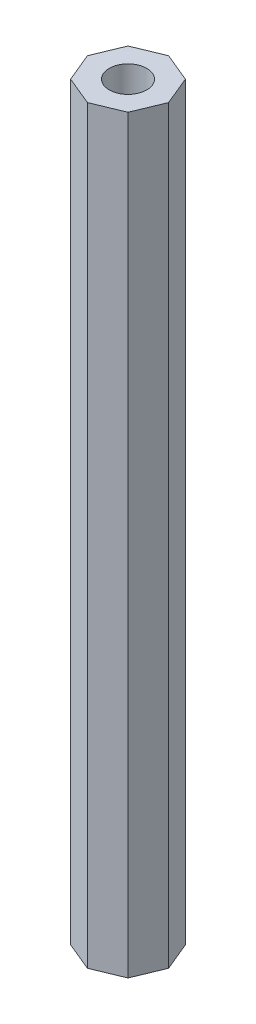
from build123d import *

# Parameters (mm, degrees)
SKETCH1_R           = 0.75
BOSS_EXTRUDE1_DEPTH = 30


with BuildPart() as part:
    # Sketch1 → Boss-Extrude1 (new body)
    with BuildSketch(Plane(origin=(0, 0, 0), x_dir=(1, 0, 0), z_dir=(0, 1, 0))):
        Polygon((1.6235883, 0), (1.148050297, 1.148050297), (0, 1.6235883), (-1.148050297, 1.148050297), (-1.6235883, 0), (-1.148050297, -1.148050297), (0, -1.6235883), (1.148050297, -1.148050297), align=None)
        with Locations(Location((0, 0, 0), (0, 0, 270))):
            Circle(SKETCH1_R, mode=Mode.SUBTRACT)
    extrude(amount=BOSS_EXTRUDE1_DEPTH)


solid = part.part
